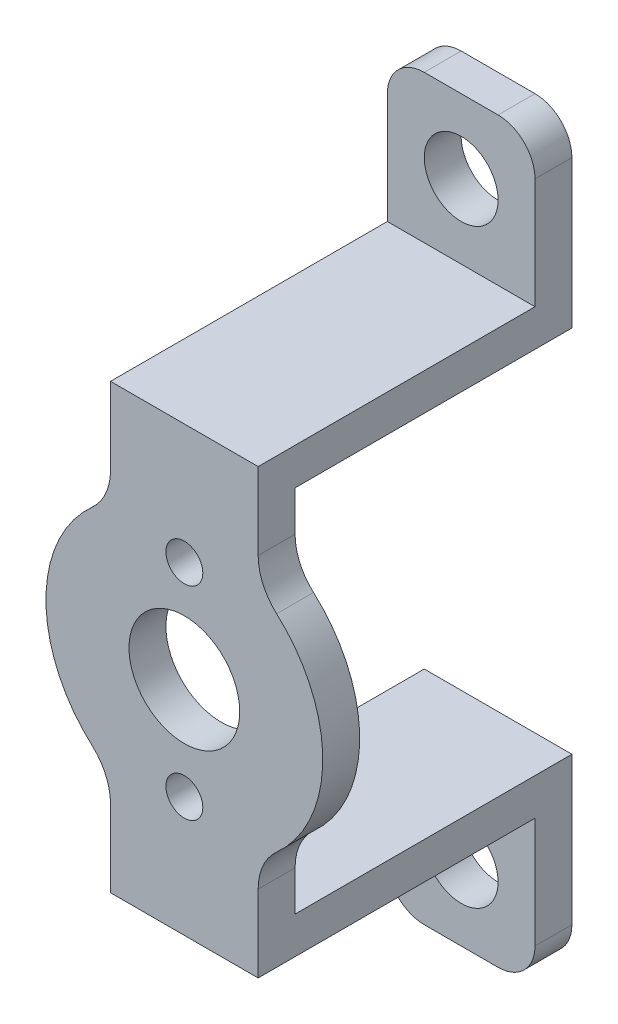
from build123d import *

# Parameters (mm, degrees)
SKETCH_1_R          = 2
EXTRUDE_1_DEPTH     = 2
SKETCH_4_W          = 8
SKETCH_4_H          = 2
EXTRUDE_3_DEPTH     = 15
SKETCH_5_R          = 1
CUT_EXTRUDE_1_DEPTH = 8
SKETCH_6_W          = 8
SKETCH_6_H          = 10
EXTRUDE_4_DEPTH     = 2
SKETCH_7_R          = 2
CUT_EXTRUDE_2_DEPTH = 2
FILLET_1_R          = 3
FILLET_2_R          = 2
SKETCH_9_R          = 3
CUT_EXTRUDE_3_DEPTH = 10


with BuildPart() as part:
    # 草图1 → 凸台-拉伸1 (new body)
    # profile 1 of 5: a face of its own
    with BuildSketch(Plane.XY):
        with BuildLine():
            Line((4, 6.34428877), (4, -6.34428877))
            ThreePointArc((4, -6.34428877), (6.566962768, -3.622844187), (7.5, 0))
            ThreePointArc((7.5, 0), (6.566962768, 3.622844187), (4, 6.34428877))
        make_face()
    # profile 2 of 5: a face of its own
    with BuildSketch(Plane.XY):
        with BuildLine():
            Line((-4, 6.34428877), (-4, -6.34428877))
            ThreePointArc((-4, -6.34428877), (0, -7.5), (4, -6.34428877))
            Line((4, -6.34428877), (4, 6.34428877))
            ThreePointArc((4, 6.34428877), (0, 7.5), (-4, 6.34428877))
        make_face()
        Circle(SKETCH_1_R, mode=Mode.SUBTRACT)
    # profile 3 of 5: a face of its own
    with BuildSketch(Plane.XY):
        with BuildLine():
            ThreePointArc((-4, 6.34428877), (-7.5, 0), (-4, -6.34428877))
            Line((-4, -6.34428877), (-4, 6.34428877))
        make_face()
    # profile 4 of 5: a face of its own
    with BuildSketch(Plane.XY):
        with BuildLine():
            Line((-4, 10), (-4, 6.34428877))
            ThreePointArc((-4, 6.34428877), (0, 7.5), (4, 6.34428877))
            Line((4, 6.34428877), (4, 10))
            Line((4, 10), (-4, 10))
        make_face()
    # profile 5 of 5: a face of its own
    with BuildSketch(Plane.XY):
        with BuildLine():
            Line((-4, -6.34428877), (-4, -10))
            Line((-4, -10), (4, -10))
            Line((4, -10), (4, -6.34428877))
            ThreePointArc((4, -6.34428877), (0, -7.5), (-4, -6.34428877))
        make_face()
    extrude(amount=EXTRUDE_1_DEPTH)

    # 草图4 → 凸台-拉伸3 (add)
    with BuildSketch(Plane.XY.offset(2)):
        with Locations((0, -11)):
            Rectangle(SKETCH_4_W, SKETCH_4_H)
        with Locations((0, 11)):
            Rectangle(SKETCH_4_W, SKETCH_4_H)
    extrude(amount=-EXTRUDE_3_DEPTH)

    # 草图5 → 切除-拉伸1 (cut)
    with BuildSketch(Plane(origin=(0, 0, 0), x_dir=(-1, 0, 0), z_dir=(0, 0, -1))):
        with Locations((0, 5.5)):
            Circle(SKETCH_5_R)
        with Locations((0, -5.5)):
            Circle(SKETCH_5_R)
    extrude(amount=-CUT_EXTRUDE_1_DEPTH, mode=Mode.SUBTRACT)

    # 草图6 → 凸台-拉伸4 (add)
    with BuildSketch(Plane(origin=(0, 0, -13), x_dir=(-1, 0, 0), z_dir=(0, 0, -1))):
        with Locations((0, -15)):
            Rectangle(SKETCH_6_W, SKETCH_6_H)
        with Locations((0, 15)):
            Rectangle(SKETCH_6_W, SKETCH_6_H)
    extrude(amount=EXTRUDE_4_DEPTH)

    # 草图7 → 切除-拉伸2 (cut)
    with BuildSketch(Plane.XY.offset(-13)):
        with Locations((0, 16)):
            Circle(SKETCH_7_R)
        with Locations((0, -16)):
            Circle(SKETCH_7_R)
    extrude(amount=-CUT_EXTRUDE_2_DEPTH, mode=Mode.SUBTRACT)

    # 圆角1
    fillet_1_edges = [part.edges().sort_by_distance(p)[0] for p in [
        (4, -6.34428877, 1),
        (-4, -6.34428877, 1),
        (-4, 6.34428877, 1),
        (4, 6.34428877, 1),
    ]]
    fillet(fillet_1_edges, radius=FILLET_1_R)

    # 圆角2
    fillet_2_edges = [part.edges().sort_by_distance(p)[0] for p in [
        (4, 20, -14),
        (-4, 20, -14),
        (4, -20, -14),
        (-4, -20, -14),
    ]]
    fillet(fillet_2_edges, radius=FILLET_2_R)

    # 草图9 → 切除-拉伸3 (cut)
    with BuildSketch(Plane.XY.offset(2)):
        Circle(SKETCH_9_R)
    extrude(amount=-CUT_EXTRUDE_3_DEPTH, mode=Mode.SUBTRACT)


solid = part.part
